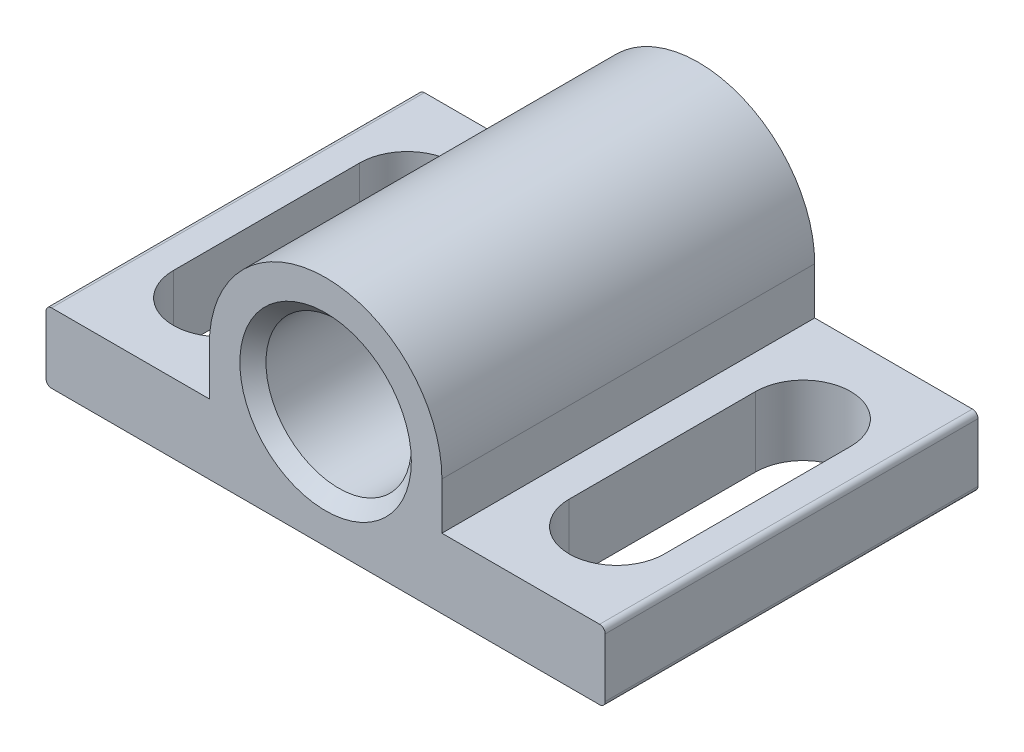
from build123d import *

# Parameters (mm, degrees)
SKETCH1_R                      = 2.5527
BOSS_EXTRUDE1_DEPTH            = 12.7
FILLET1_R                      = 0.381
F_1_2_0_5_DIAMETER_HOLE2_D     = 9.906
F_1_2_0_5_DIAMETER_HOLE2_DEPTH = 19.05
F_1_2_0_5_DIAMETER_HOLE2_TIP   = 5.697774721
CHAMFER2_SIZE                  = 0.889
CUT_EXTRUDE1_DEPTH             = 9.906


with BuildPart() as part:
    # Sketch1 → Boss-Extrude1 (new, symmetric)
    with BuildSketch(Plane.XY):
        with BuildLine():
            Line((-19.05, -2.3749), (19.05, -2.3749))
            Line((19.05, -2.3749), (19.05, 2.3749))
            Line((19.05, 2.3749), (7.9248, 2.3749))
            Line((7.9248, 2.3749), (7.9248, 5.5753))
            ThreePointArc((7.9248, 5.5753), (0, 13.5001), (-7.9248, 5.5753))
            Line((-7.9248, 5.5753), (-7.9248, 2.3749))
            Line((-7.9248, 2.3749), (-19.05, 2.3749))
            Line((-19.05, 2.3749), (-19.05, -2.3749))
        make_face()
        with Locations((0, 5.5753)):
            Circle(SKETCH1_R, mode=Mode.SUBTRACT)
    extrude(amount=BOSS_EXTRUDE1_DEPTH, both=True)

    # Fillet1
    fillet1_edges = [part.edges().sort_by_distance(p)[0] for p in [
        (19.05, 2.3749, 0),
        (19.05, -2.3749, 0),
        (-19.05, -2.3749, 0),
        (-19.05, 2.3749, 0),
    ]]
    fillet(fillet1_edges, radius=FILLET1_R)

    # 1/2 (0.5) Diameter Hole2
    with Locations(Plane.XY.offset(12.7)):
        with Locations((0, 5.5753)):
            Hole(F_1_2_0_5_DIAMETER_HOLE2_D / 2, depth=F_1_2_0_5_DIAMETER_HOLE2_DEPTH)
            with Locations((0, 0, -(F_1_2_0_5_DIAMETER_HOLE2_DEPTH + F_1_2_0_5_DIAMETER_HOLE2_TIP / 2))):  # 82° drill point
                Cone(0, F_1_2_0_5_DIAMETER_HOLE2_D / 2, F_1_2_0_5_DIAMETER_HOLE2_TIP, mode=Mode.SUBTRACT)

    # Chamfer2
    chamfer2_edges = [part.edges().sort_by_distance(p)[0] for p in [
        (4.953, 5.5753, 12.7),
    ]]
    chamfer(chamfer2_edges, length=CHAMFER2_SIZE)

    # Sketch9 → Cut-Extrude1 (cut)
    with BuildSketch(Plane(origin=(0, 2.3749, 0), x_dir=(1, 0, 0), z_dir=(0, 1, 0))):
        with BuildLine():
            Line((16.7259, 6.35), (16.7259, -6.35))
            ThreePointArc((16.7259, -6.35), (13.4874, -9.5885), (10.2489, -6.35))
            Line((10.2489, -6.35), (10.2489, 6.35))
            ThreePointArc((10.2489, 6.35), (13.4874, 9.5885), (16.7259, 6.35))
        make_face()
        with BuildLine():
            Line((-16.7259, 6.35), (-16.7259, -6.35))
            ThreePointArc((-16.7259, -6.35), (-13.4874, -9.5885), (-10.2489, -6.35))
            Line((-10.2489, -6.35), (-10.2489, 6.35))
            ThreePointArc((-10.2489, 6.35), (-13.4874, 9.5885), (-16.7259, 6.35))
        make_face()
    extrude(amount=-CUT_EXTRUDE1_DEPTH, mode=Mode.SUBTRACT)


solid = part.part
